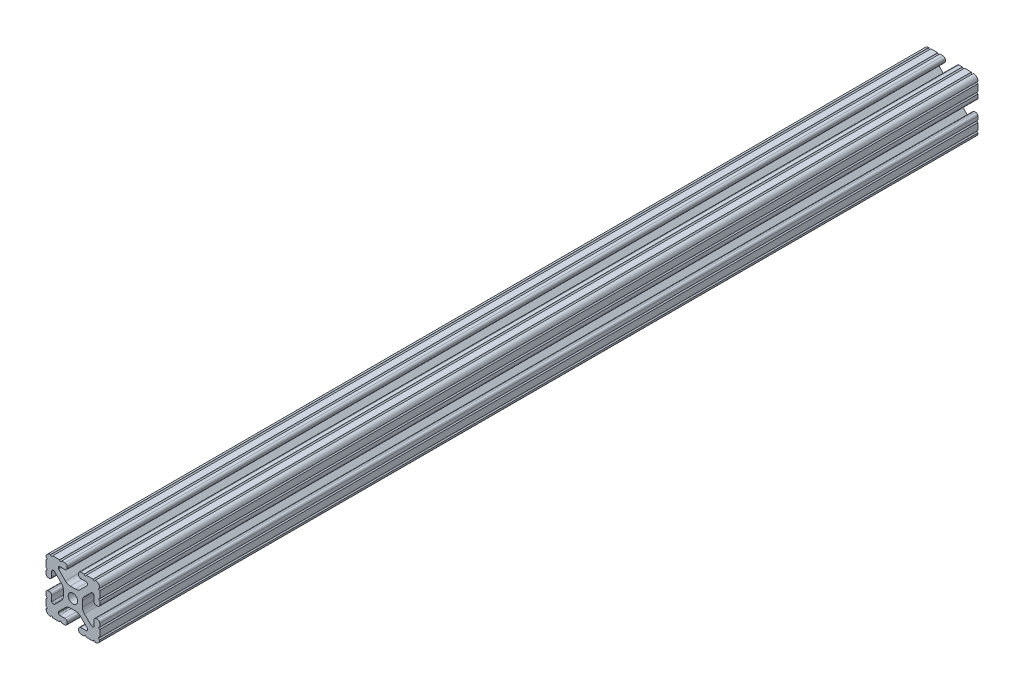
from build123d import *

# Parameters (mm, degrees)
SKETCH1_R           = 3.3274
BOSS_EXTRUDE1_DEPTH = 622.3


with BuildPart() as part:
    # Sketch1 → Boss-Extrude1 (new body)
    with BuildSketch(Plane.XY):
        with BuildLine():
            Line((-14.097, 10.287), (-13.528918, 10.287))
            ThreePointArc((-13.528918, 10.287), (-13.188712428, 10.219328904), (-12.900300071, 10.026617928))
            Line((-12.900300071, 10.026617928), (-8.129198975, 5.255516832))
            ThreePointArc((-8.129198975, 5.255516832), (-7.09957176, 3.71457081), (-6.738014764, 1.896901043))
            Line((-6.738014764, 1.896901043), (-6.738014764, -1.896901043))
            ThreePointArc((-6.738014764, -1.896901043), (-7.09957176, -3.71457081), (-8.129198975, -5.255516832))
            Line((-8.129198975, -5.255516832), (-12.900300071, -10.026617928))
            ThreePointArc((-12.900300071, -10.026617928), (-13.188712428, -10.219328904), (-13.528918, -10.287))
            Line((-13.528918, -10.287), (-14.097, -10.287))
            ThreePointArc((-14.097, -10.287), (-14.725617928, -10.026617928), (-14.986, -9.398))
            Line((-14.986, -9.398), (-14.986, -5.6388))
            ThreePointArc((-14.986, -5.6388), (-15.447248241, -4.525248241), (-16.5608, -4.064))
            Line((-16.5608, -4.064), (-17.4752, -4.064))
            ThreePointArc((-17.4752, -4.064), (-18.588751759, -4.525248241), (-19.05, -5.6388))
            Line((-19.05, -5.6388), (-19.05, -7.9756))
            ThreePointArc((-19.05, -7.9756), (-18.288, -8.7376), (-19.05, -9.4996))
            Line((-19.05, -9.4996), (-19.05, -14.3256))
            ThreePointArc((-19.05, -14.3256), (-18.288, -15.0876), (-19.05, -15.8496))
            Line((-19.05, -15.8496), (-19.05, -15.875))
            ThreePointArc((-19.05, -15.875), (-18.12006403, -18.12006403), (-15.875, -19.05))
            Line((-15.875, -19.05), (-15.8496, -19.05))
            ThreePointArc((-15.8496, -19.05), (-15.0876, -18.288), (-14.3256, -19.05))
            Line((-14.3256, -19.05), (-9.4996, -19.05))
            ThreePointArc((-9.4996, -19.05), (-8.7376, -18.288), (-7.9756, -19.05))
            Line((-7.9756, -19.05), (-5.6388, -19.05))
            ThreePointArc((-5.6388, -19.05), (-4.525248241, -18.588751759), (-4.064, -17.4752))
            Line((-4.064, -17.4752), (-4.064, -16.5608))
            ThreePointArc((-4.064, -16.5608), (-4.525248241, -15.447248241), (-5.6388, -14.986))
            Line((-5.6388, -14.986), (-9.398, -14.986))
            ThreePointArc((-9.398, -14.986), (-10.026617928, -14.725617928), (-10.287, -14.097))
            Line((-10.287, -14.097), (-10.287, -13.528918))
            ThreePointArc((-10.287, -13.528918), (-10.219328904, -13.188712428), (-10.026617928, -12.900300071))
            Line((-10.026617928, -12.900300071), (-5.255516832, -8.129198975))
            ThreePointArc((-5.255516832, -8.129198975), (-3.71457081, -7.09957176), (-1.896901043, -6.738014764))
            Line((-1.896901043, -6.738014764), (1.896901043, -6.738014764))
            ThreePointArc((1.896901043, -6.738014764), (3.71457081, -7.09957176), (5.255516832, -8.129198975))
            Line((5.255516832, -8.129198975), (10.026617928, -12.900300071))
            ThreePointArc((10.026617928, -12.900300071), (10.219328904, -13.188712428), (10.287, -13.528918))
            Line((10.287, -13.528918), (10.287, -14.097))
            ThreePointArc((10.287, -14.097), (10.026617928, -14.725617928), (9.398, -14.986))
            Line((9.398, -14.986), (5.6388, -14.986))
            ThreePointArc((5.6388, -14.986), (4.525248241, -15.447248241), (4.064, -16.5608))
            Line((4.064, -16.5608), (4.064, -17.4752))
            ThreePointArc((4.064, -17.4752), (4.525248241, -18.588751759), (5.6388, -19.05))
            Line((5.6388, -19.05), (7.9756, -19.05))
            ThreePointArc((7.9756, -19.05), (8.7376, -18.288), (9.4996, -19.05))
            Line((9.4996, -19.05), (14.3256, -19.05))
            ThreePointArc((14.3256, -19.05), (15.0876, -18.288), (15.8496, -19.05))
            Line((15.8496, -19.05), (15.875, -19.05))
            ThreePointArc((15.875, -19.05), (18.12006403, -18.12006403), (19.05, -15.875))
            Line((19.05, -15.875), (19.05, -15.8496))
            ThreePointArc((19.05, -15.8496), (18.288, -15.0876), (19.05, -14.3256))
            Line((19.05, -14.3256), (19.05, -9.4996))
            ThreePointArc((19.05, -9.4996), (18.288, -8.7376), (19.05, -7.9756))
            Line((19.05, -7.9756), (19.05, -5.6388))
            ThreePointArc((19.05, -5.6388), (18.588751759, -4.525248241), (17.4752, -4.064))
            Line((17.4752, -4.064), (16.5608, -4.064))
            ThreePointArc((16.5608, -4.064), (15.447248241, -4.525248241), (14.986, -5.6388))
            Line((14.986, -5.6388), (14.986, -9.398))
            ThreePointArc((14.986, -9.398), (14.725617928, -10.026617928), (14.097, -10.287))
            Line((14.097, -10.287), (13.528918, -10.287))
            ThreePointArc((13.528918, -10.287), (13.188712428, -10.219328904), (12.900300071, -10.026617928))
            Line((12.900300071, -10.026617928), (8.129198975, -5.255516832))
            ThreePointArc((8.129198975, -5.255516832), (7.09957176, -3.71457081), (6.738014764, -1.896901043))
            Line((6.738014764, -1.896901043), (6.738014764, 1.896901043))
            ThreePointArc((6.738014764, 1.896901043), (7.09957176, 3.71457081), (8.129198975, 5.255516832))
            Line((8.129198975, 5.255516832), (12.900300071, 10.026617928))
            ThreePointArc((12.900300071, 10.026617928), (13.188712428, 10.219328904), (13.528918, 10.287))
            Line((13.528918, 10.287), (14.097, 10.287))
            ThreePointArc((14.097, 10.287), (14.725617928, 10.026617928), (14.986, 9.398))
            Line((14.986, 9.398), (14.986, 5.6388))
            ThreePointArc((14.986, 5.6388), (15.447248241, 4.525248241), (16.5608, 4.064))
            Line((16.5608, 4.064), (17.4752, 4.064))
            ThreePointArc((17.4752, 4.064), (18.588751759, 4.525248241), (19.05, 5.6388))
            Line((19.05, 5.6388), (19.05, 7.9756))
            ThreePointArc((19.05, 7.9756), (18.288, 8.7376), (19.05, 9.4996))
            Line((19.05, 9.4996), (19.05, 14.3256))
            ThreePointArc((19.05, 14.3256), (18.288, 15.0876), (19.05, 15.8496))
            Line((19.05, 15.8496), (19.05, 15.875))
            ThreePointArc((19.05, 15.875), (18.12006403, 18.12006403), (15.875, 19.05))
            Line((15.875, 19.05), (15.8496, 19.05))
            ThreePointArc((15.8496, 19.05), (15.0876, 18.288), (14.3256, 19.05))
            Line((14.3256, 19.05), (9.4996, 19.05))
            ThreePointArc((9.4996, 19.05), (8.7376, 18.288), (7.9756, 19.05))
            Line((7.9756, 19.05), (5.6388, 19.05))
            ThreePointArc((5.6388, 19.05), (4.525248241, 18.588751759), (4.064, 17.4752))
            Line((4.064, 17.4752), (4.064, 16.5608))
            ThreePointArc((4.064, 16.5608), (4.525248241, 15.447248241), (5.6388, 14.986))
            Line((5.6388, 14.986), (9.398, 14.986))
            ThreePointArc((9.398, 14.986), (10.026617928, 14.725617928), (10.287, 14.097))
            Line((10.287, 14.097), (10.287, 13.528918))
            ThreePointArc((10.287, 13.528918), (10.219328904, 13.188712428), (10.026617928, 12.900300071))
            Line((10.026617928, 12.900300071), (5.255516832, 8.129198975))
            ThreePointArc((5.255516832, 8.129198975), (3.71457081, 7.09957176), (1.896901043, 6.738014764))
            Line((1.896901043, 6.738014764), (-1.896901043, 6.738014764))
            ThreePointArc((-1.896901043, 6.738014764), (-3.71457081, 7.09957176), (-5.255516832, 8.129198975))
            Line((-5.255516832, 8.129198975), (-10.026617928, 12.900300071))
            ThreePointArc((-10.026617928, 12.900300071), (-10.219328904, 13.188712428), (-10.287, 13.528918))
            Line((-10.287, 13.528918), (-10.287, 14.097))
            ThreePointArc((-10.287, 14.097), (-10.026617928, 14.725617928), (-9.398, 14.986))
            Line((-9.398, 14.986), (-5.6388, 14.986))
            ThreePointArc((-5.6388, 14.986), (-4.525248241, 15.447248241), (-4.064, 16.5608))
            Line((-4.064, 16.5608), (-4.064, 17.4752))
            ThreePointArc((-4.064, 17.4752), (-4.525248241, 18.588751759), (-5.6388, 19.05))
            Line((-5.6388, 19.05), (-7.9756, 19.05))
            ThreePointArc((-7.9756, 19.05), (-8.7376, 18.288), (-9.4996, 19.05))
            Line((-9.4996, 19.05), (-14.3256, 19.05))
            ThreePointArc((-14.3256, 19.05), (-15.0876, 18.288), (-15.8496, 19.05))
            Line((-15.8496, 19.05), (-15.875, 19.05))
            ThreePointArc((-15.875, 19.05), (-18.12006403, 18.12006403), (-19.05, 15.875))
            Line((-19.05, 15.875), (-19.05, 15.8496))
            ThreePointArc((-19.05, 15.8496), (-18.288, 15.0876), (-19.05, 14.3256))
            Line((-19.05, 14.3256), (-19.05, 9.4996))
            ThreePointArc((-19.05, 9.4996), (-18.288, 8.7376), (-19.05, 7.9756))
            Line((-19.05, 7.9756), (-19.05, 5.6388))
            ThreePointArc((-19.05, 5.6388), (-18.588751759, 4.525248241), (-17.4752, 4.064))
            Line((-17.4752, 4.064), (-16.5608, 4.064))
            ThreePointArc((-16.5608, 4.064), (-15.447248241, 4.525248241), (-14.986, 5.6388))
            Line((-14.986, 5.6388), (-14.986, 9.398))
            ThreePointArc((-14.986, 9.398), (-14.725617928, 10.026617928), (-14.097, 10.287))
        make_face()
        Circle(SKETCH1_R, mode=Mode.SUBTRACT)
    extrude(amount=BOSS_EXTRUDE1_DEPTH)


solid = part.part
